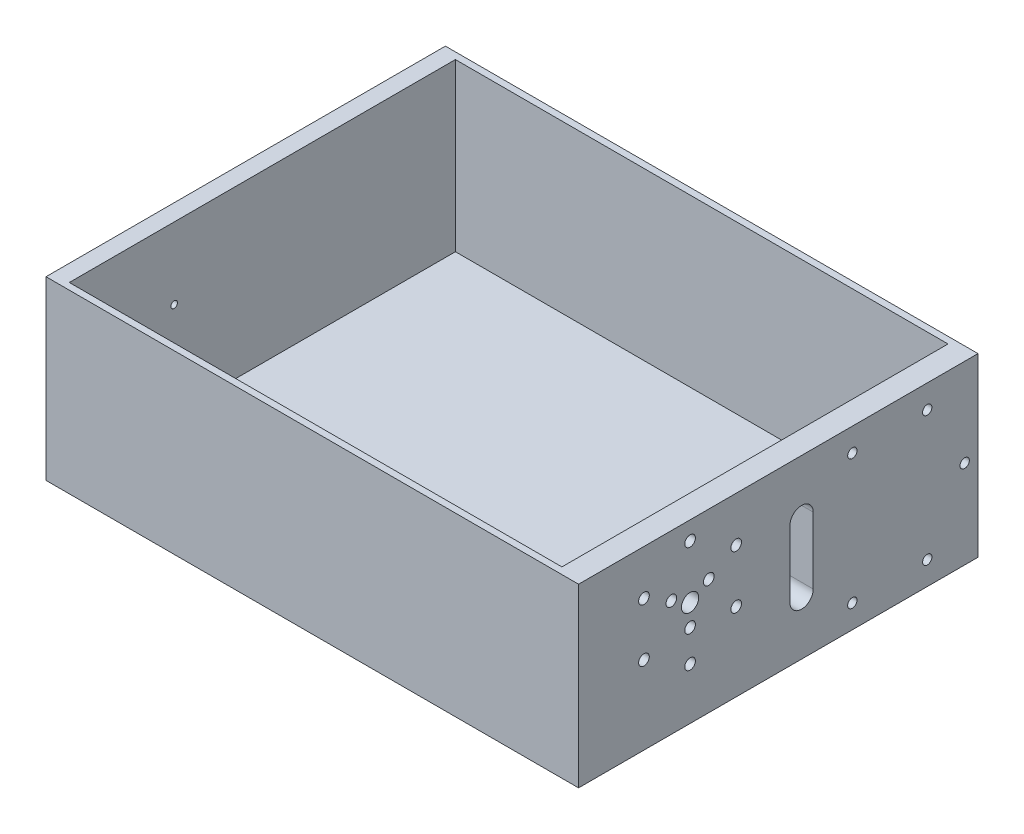
from build123d import *

# Parameters (mm, degrees)
SKETCH1_W           = 160
SKETCH1_H           = 120
BOSS_EXTRUDE1_DEPTH = 3
SKETCH2_W           = 160
SKETCH2_H           = 120
SKETCH2_W_2         = 148
SKETCH2_H_2         = 116
BOSS_EXTRUDE2_DEPTH = 50
SKETCH3_R           = 1
CUT_EXTRUDE1_DEPTH  = 179.910592196
SKETCH4_R           = 1.6
SKETCH4_R_2         = 2.6
SKETCH4_R_3         = 1.4
CUT_EXTRUDE2_DEPTH  = 173.678892746
SKETCH5_W           = 5.5
SKETCH5_H           = 5.5
NUT_CAVITIES_DEPTH  = 2.5
CUT_EXTRUDE3_DEPTH  = 10


with BuildPart() as part:
    # Sketch1 → Boss-Extrude1 (new body)
    with BuildSketch(Plane(origin=(0, 0, 0), x_dir=(1, 0, 0), z_dir=(0, 1, 0))):
        Rectangle(SKETCH1_W, SKETCH1_H)
    extrude(amount=BOSS_EXTRUDE1_DEPTH)

    # Sketch2 → Boss-Extrude2 (add)
    with BuildSketch(Plane(origin=(0, 3, 0), x_dir=(1, 0, 0), z_dir=(0, 1, 0))):
        Rectangle(SKETCH2_W, SKETCH2_H)
        with Locations((-1, 0)):
            Rectangle(SKETCH2_W_2, SKETCH2_H_2, mode=Mode.SUBTRACT)
    extrude(amount=BOSS_EXTRUDE2_DEPTH)

    # Sketch3 → Cut-Extrude1 (cut, through all)
    with BuildSketch(Plane(origin=(80, 0, 0), x_dir=(0, 0, -1), z_dir=(1, 0, 0))):
        with Locations((-26.5, 31.5)):
            Circle(SKETCH3_R)
    extrude(amount=-CUT_EXTRUDE1_DEPTH, mode=Mode.SUBTRACT)

    # Sketch4 → Cut-Extrude2 (cut, through all)
    with BuildSketch(Plane.ZY.offset(-73)):
        with Locations((26.5, 25)):
            Circle(SKETCH4_R)
        with Locations((32.129165125, 34.75)):
            Circle(SKETCH4_R)
        with Locations((20.870834875, 34.75)):
            Circle(SKETCH4_R)
        with Locations((26.5, 31.5)):
            Circle(SKETCH4_R_2)
        with Locations((26.5, 47.5)):
            Circle(SKETCH4_R)
        with Locations((12.643593539, 39.5)):
            Circle(SKETCH4_R)
        with Locations((12.643593539, 23.5)):
            Circle(SKETCH4_R)
        with Locations((26.5, 15.5)):
            Circle(SKETCH4_R)
        with Locations((40.356406461, 23.5)):
            Circle(SKETCH4_R)
        with Locations((40.356406461, 39.5)):
            Circle(SKETCH4_R)
        with Locations((-22.25, 45.985571585)):
            Circle(SKETCH4_R_3)
        with Locations((-44.75, 45.985571585)):
            Circle(SKETCH4_R_3)
        with Locations((-56, 26.5)):
            Circle(SKETCH4_R_3)
        with Locations((-44.75, 7.014428415)):
            Circle(SKETCH4_R_3)
        with Locations((-22.25, 7.014428415)):
            Circle(SKETCH4_R_3)
    extrude(amount=-CUT_EXTRUDE2_DEPTH, mode=Mode.SUBTRACT)

    # Sketch5 → Nut cavities (cut)
    with BuildSketch(Plane.ZY.offset(-73)):
        with Locations((12.643593539, 39.5)):
            Rectangle(SKETCH5_W, SKETCH5_H)
        with Locations((26.5, 47.5)):
            Rectangle(SKETCH5_W, SKETCH5_H)
        with Locations((20.870834875, 34.75)):
            Rectangle(SKETCH5_W, SKETCH5_H)
        with Locations((12.643593539, 23.5)):
            Rectangle(SKETCH5_W, SKETCH5_H)
        with Locations((26.5, 15.5)):
            Rectangle(SKETCH5_W, SKETCH5_H)
        with Locations((26.5, 25)):
            Rectangle(SKETCH5_W, SKETCH5_H)
        with Locations((40.356406461, 23.5)):
            Rectangle(SKETCH5_W, SKETCH5_H)
        with Locations((32.129165125, 34.75)):
            Rectangle(SKETCH5_W, SKETCH5_H)
        with Locations((40.356406461, 39.5)):
            Rectangle(SKETCH5_W, SKETCH5_H)
    extrude(amount=-NUT_CAVITIES_DEPTH, mode=Mode.SUBTRACT)

    # Sketch8 → Cut-Extrude3 (cut)
    with BuildSketch(Plane(origin=(80, 0, 0), x_dir=(0, 0, -1), z_dir=(1, 0, 0))):
        with BuildLine():
            Line((10.5, 36.5), (10.5, 16.5))
            ThreePointArc((10.5, 16.5), (7, 13), (3.5, 16.5))
            Line((3.5, 16.5), (3.5, 36.5))
            ThreePointArc((3.5, 36.5), (7, 40), (10.5, 36.5))
        make_face()
    extrude(amount=-CUT_EXTRUDE3_DEPTH, mode=Mode.SUBTRACT)


solid = part.part
